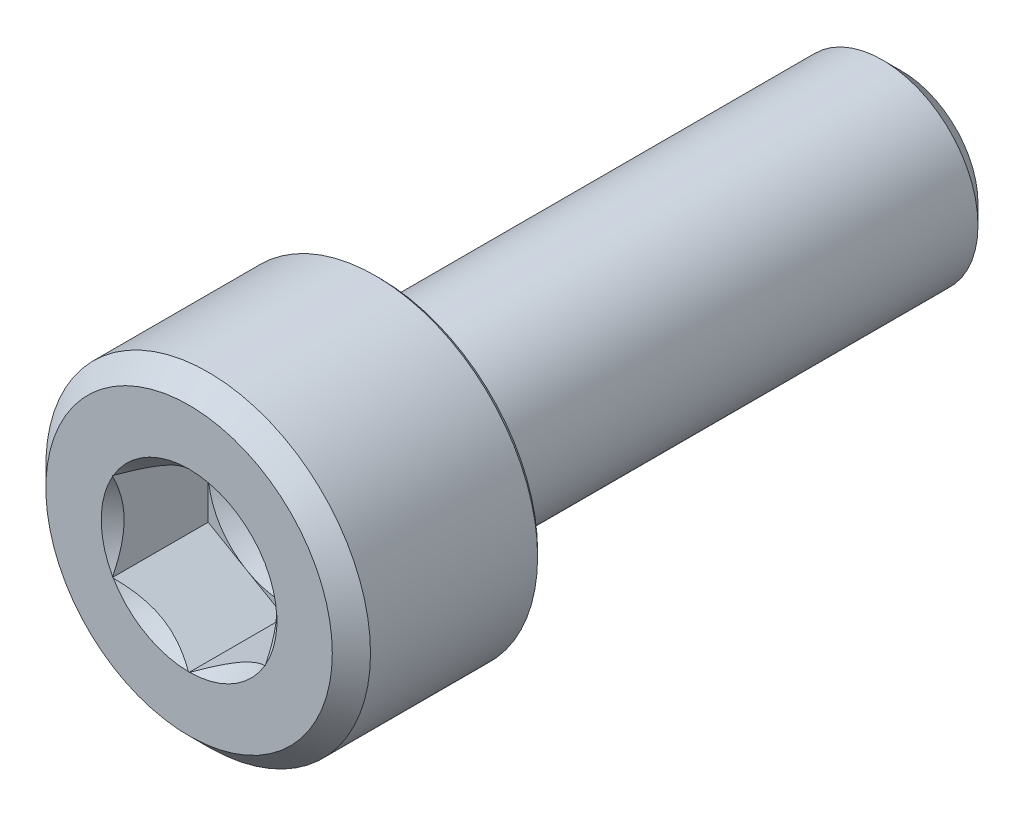
from build123d import *

# Parameters (mm, degrees)
CORTAR_EXTRUIR1_DEPTH = 2.5


with BuildPart() as part:
    # Croquis1 → Revolución1 (revolve)
    with BuildSketch(Plane(origin=(0, 0, 0), x_dir=(0, 0, -1), z_dir=(1, 0, 0)), mode=Mode.PRIVATE) as revoluci_n1_sk:
        Polygon((0, 0), (15, 0), (15, 2), (14.5, 2.5), (1.945299462, 2.5), (1.345299462, 2.541956087), (1.345299462, 4.125), (1.220299462, 4.25), (-3.154700538, 4.25), (-3.654700538, 3.75), (-3.654700538, 2.3), (-3.354700538, 2), (-1.154700538, 2), align=None)
    revolve(revoluci_n1_sk.sketch.rotate(Axis((0, 0, 0), (0, 0, -1)), 90), axis=Axis((0, 0, 0), (0, 0, -1)))

    # Croquis2 → Cortar-Extruir1 (cut)
    with BuildSketch(Plane.XY.offset(3.654700538)):
        Polygon((0, 2.309401077), (-2, 1.154700538), (-2, -1.154700538), (0, -2.309401077), (2, -1.154700538), (2, 1.154700538), align=None)
    extrude(amount=-CORTAR_EXTRUIR1_DEPTH, mode=Mode.SUBTRACT)


solid = part.part
